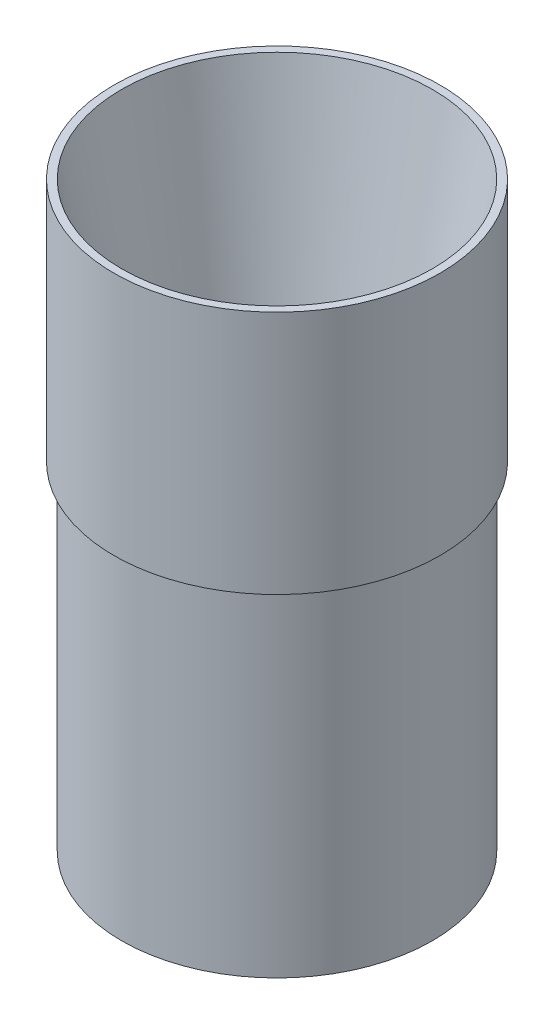
from build123d import *


with BuildPart() as part:
    # Sketch1 → Revolve1 (revolve)
    with BuildSketch(Plane.XY):
        Polygon((2.38125, 0), (0, 0), (0, 105.145818385), (-2.38125, 105.145818385), (-2.38125, 181.345818385), (0, 181.345818385), (23.01875, 50.8), (2.38125, 50.8), align=None)
    revolve(axis=Axis((48.41875, 283.939349901, 0), (0, -1, 0)))


solid = part.part
